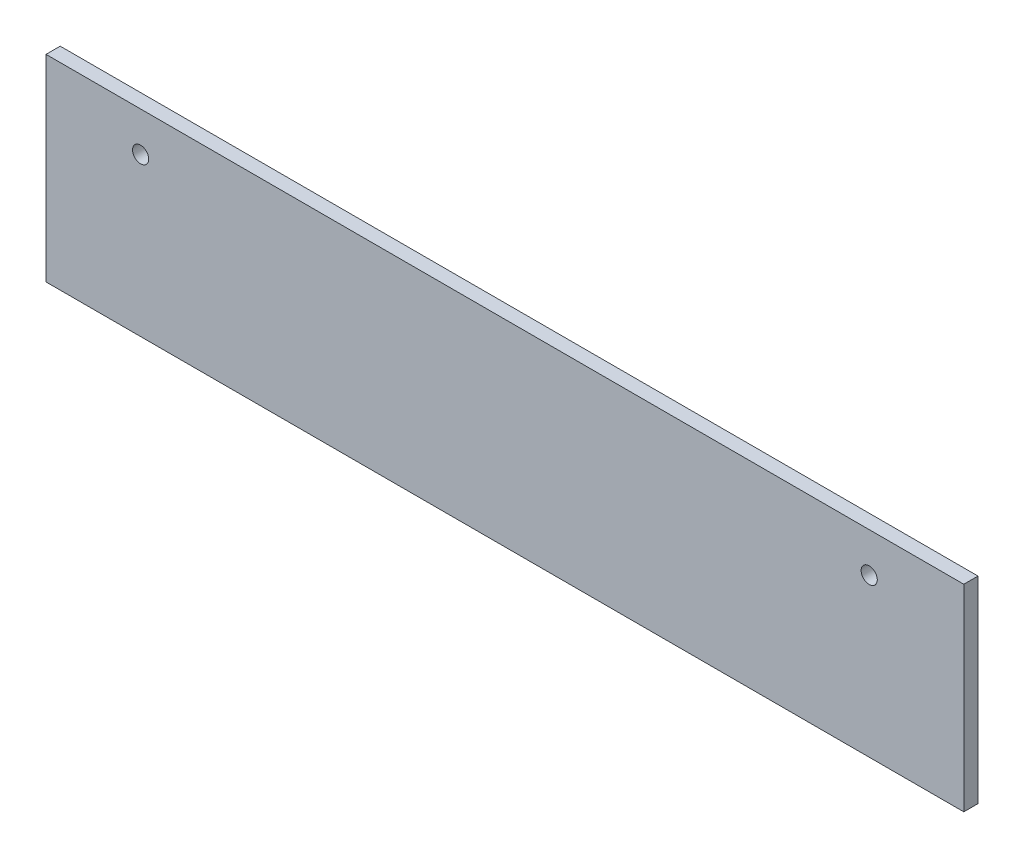
from build123d import *

# Parameters (mm, degrees)
ESQUISSE2_W        = 232.8
ESQUISSE2_H        = 50
ESQUISSE2_R        = 2.05
BOSS_EXTRU_1_DEPTH = 3.6


with BuildPart() as part:
    # Esquisse2 → Boss.-Extru.1 (new body)
    with BuildSketch(Plane.XY):
        Rectangle(ESQUISSE2_W, ESQUISSE2_H)
        with Locations((-92.4, 15)):
            Circle(ESQUISSE2_R, mode=Mode.SUBTRACT)
        with Locations(Location((92.4, 15, 0), (0, 0, 180))):
            Circle(ESQUISSE2_R, mode=Mode.SUBTRACT)
    extrude(amount=BOSS_EXTRU_1_DEPTH)


solid = part.part
